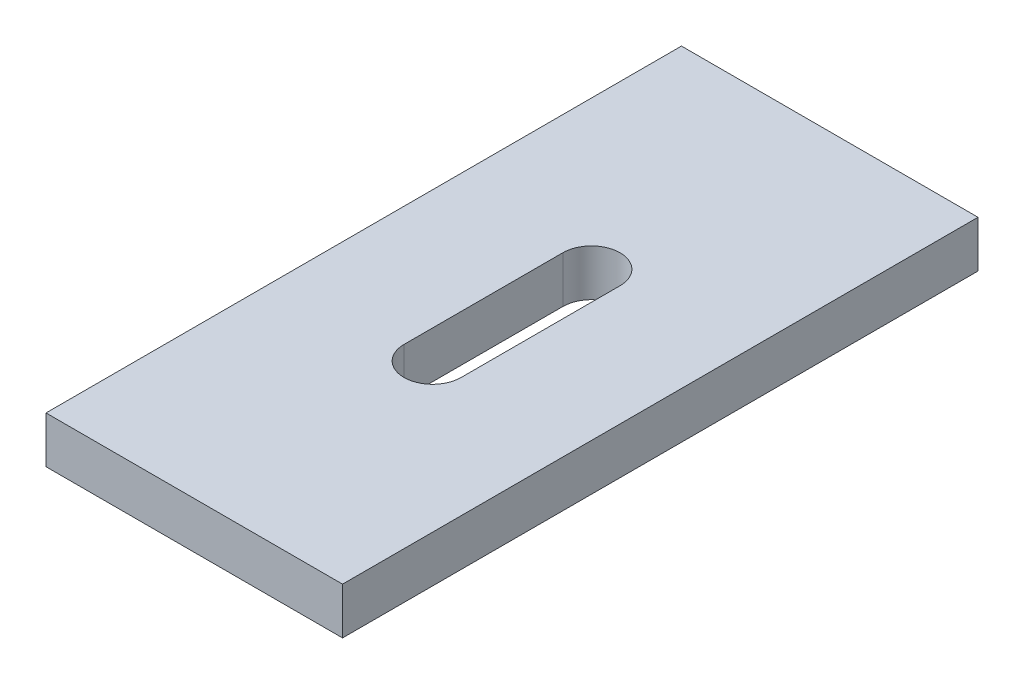
from build123d import *

# Parameters (mm, degrees)
SKETCH1_W           = 17.78
SKETCH1_H           = 2.794
BOSS_EXTRUDE1_DEPTH = 19.05
CUT_EXTRUDE1_DEPTH  = 22.207098717


with BuildPart() as part:
    # Sketch1 → Boss-Extrude1 (new, symmetric)
    with BuildSketch(Plane.XY):
        Rectangle(SKETCH1_W, SKETCH1_H)
    extrude(amount=BOSS_EXTRUDE1_DEPTH, both=True)

    # Sketch2 → Cut-Extrude1 (cut, through all)
    with BuildSketch(Plane(origin=(0, 1.397, 0), x_dir=(1, 0, 0), z_dir=(0, 1, 0))):
        with BuildLine():
            Line((-1.7145, -4.7625), (-1.7145, 4.7625))
            ThreePointArc((-1.7145, 4.7625), (0, 6.477), (1.7145, 4.7625))
            Line((1.7145, 4.7625), (1.7145, -4.7625))
            ThreePointArc((1.7145, -4.7625), (0, -6.477), (-1.7145, -4.7625))
        make_face()
    extrude(amount=-CUT_EXTRUDE1_DEPTH, mode=Mode.SUBTRACT)


solid = part.part
